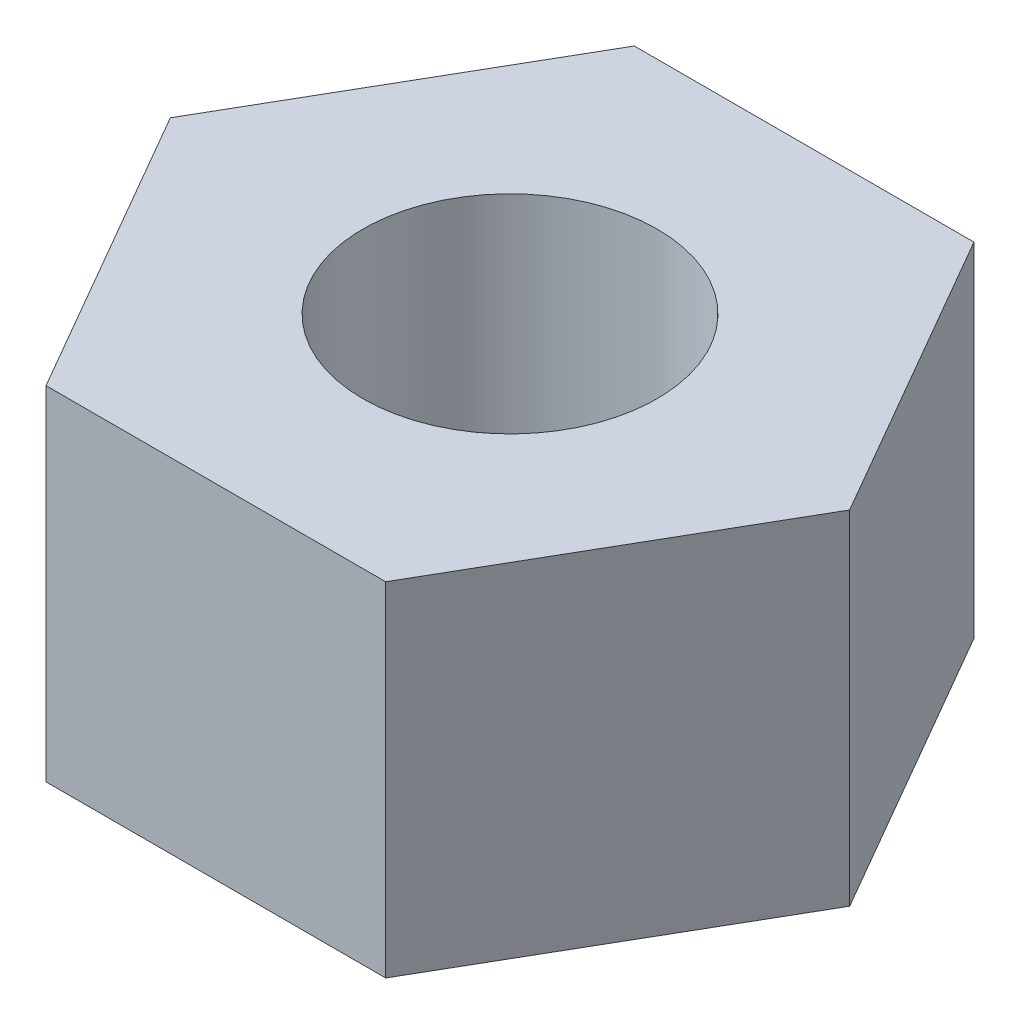
from build123d import *

# Parameters (mm, degrees)
SKETCH1_R           = 15
BOSS_EXTRUDE1_DEPTH = 35


with BuildPart() as part:
    # Sketch1 → Boss-Extrude1 (new body)
    with BuildSketch(Plane(origin=(0, 0, 0), x_dir=(1, 0, 0), z_dir=(0, 1, 0))):
        Polygon((34.641016151, 0), (17.320508076, 30), (-17.320508076, 30), (-34.641016151, 0), (-17.320508076, -30), (17.320508076, -30), align=None)
        with Locations(Location((0, 0, 0), (0, 0, 270))):
            Circle(SKETCH1_R, mode=Mode.SUBTRACT)
    extrude(amount=BOSS_EXTRUDE1_DEPTH)


solid = part.part
